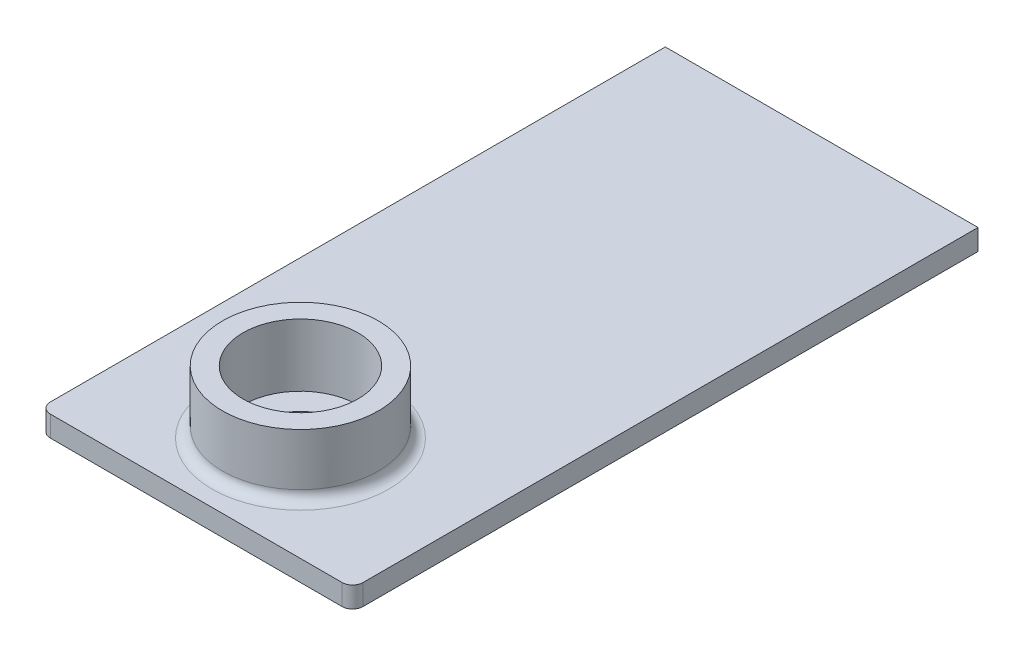
from build123d import *

# Parameters (mm, degrees)
SKETCH1_W           = 38.1
SKETCH1_H           = 76.2
BOSS_EXTRUDE1_DEPTH = 1.27
BOSS_EXTRUDE2_DEPTH = 7.62
CUT_EXTRUDE2_DEPTH  = 7.62
FILLET1_R           = 1.27
FILLET2_R           = 1.27


with BuildPart() as part:
    # Sketch1 → Boss-Extrude1 (new, symmetric)
    with BuildSketch(Plane(origin=(0, 0, 0), x_dir=(1, 0, 0), z_dir=(0, 1, 0))):
        with Locations((19.05, 38.1)):
            Rectangle(SKETCH1_W, SKETCH1_H)
    extrude(amount=BOSS_EXTRUDE1_DEPTH, both=True)

    # Sketch3 → Boss-Extrude2 (add)
    with BuildSketch(Plane(origin=(0, 1.27, 0), x_dir=(1, 0, 0), z_dir=(0, 1, 0))):
        with BuildLine():
            ThreePointArc((28.55, 12.7), (12.332485579, 19.417514421), (19.05, 3.2))
            ThreePointArc((19.05, 3.2), (25.767514421, 5.982485579), (28.55, 12.7))
        make_face()
        with BuildLine():
            ThreePointArc((26.05, 12.7), (23.999747468, 7.750252532), (19.05, 5.7))
            ThreePointArc((19.05, 5.7), (14.100252532, 17.649747468), (26.05, 12.7))
        make_face(mode=Mode.SUBTRACT)
    extrude(amount=BOSS_EXTRUDE2_DEPTH)

    # Sketch3<5> → Cut-Extrude2 (cut)
    with BuildSketch(Plane(origin=(0, 1.27, 0), x_dir=(1, 0, 0), z_dir=(0, 1, 0))):
        with BuildLine():
            ThreePointArc((23.05, 12.7), (16.221572875, 15.528427125), (19.05, 8.7))
            ThreePointArc((19.05, 8.7), (21.878427125, 9.871572875), (23.05, 12.7))
        make_face()
    extrude(amount=-CUT_EXTRUDE2_DEPTH, mode=Mode.SUBTRACT)

    # Fillet1
    fillet1_edges = [part.edges().sort_by_distance(p)[0] for p in [
        (19.05, 1.27, -22.2),
    ]]
    fillet(fillet1_edges, radius=FILLET1_R)

    # Fillet2
    fillet2_edges = [part.edges().sort_by_distance(p)[0] for p in [
        (38.1, 0, 0),
        (0, 0, 0),
    ]]
    fillet(fillet2_edges, radius=FILLET2_R)


solid = part.part
